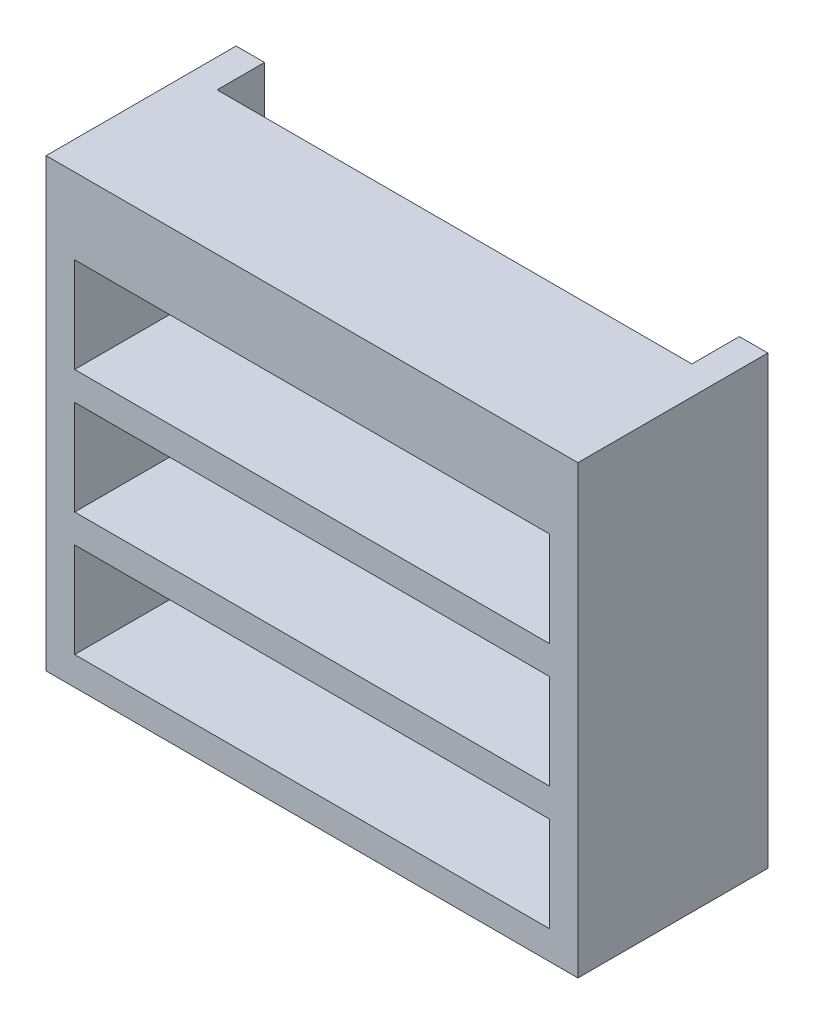
from build123d import *

# Parameters (mm, degrees)
SKETCH_2_W      = 50
SKETCH_2_H      = 10
EXTRUDE_1_DEPTH = 15
SKETCH_3_W      = 3
SKETCH_3_H      = 42
EXTRUDE_2_DEPTH = 5
SKETCH_4_W      = 3
SKETCH_4_H      = 5
EXTRUDE_4_DEPTH = 5
EXTRUDE_5_DEPTH = 5


with BuildPart() as part:
    # 草图2 → 凸台-拉伸1 (new body)
    with BuildSketch(Plane.XY):
        Polygon((-29.132569558, 18.56468986), (-32.132569558, 18.56468986), (-32.132569558, -23.43531014), (-29.132569558, -23.43531014), (23.867430442, -23.43531014), (23.867430442, 18.56468986), align=None)
        with Locations((-4.132569558, 10.56468986)):
            Rectangle(SKETCH_2_W, SKETCH_2_H, mode=Mode.SUBTRACT)
        with Locations((-4.132569558, -2.43531014)):
            Rectangle(SKETCH_2_W, SKETCH_2_H, mode=Mode.SUBTRACT)
        with Locations((-4.132569558, -15.43531014)):
            Rectangle(SKETCH_2_W, SKETCH_2_H, mode=Mode.SUBTRACT)
    extrude(amount=EXTRUDE_1_DEPTH)

    # 草图3 → 凸台-拉伸2 (add)
    with BuildSketch(Plane(origin=(0, 0, 0), x_dir=(-1, 0, 0), z_dir=(0, 0, -1))):
        with Locations((30.632569558, -2.43531014)):
            Rectangle(SKETCH_3_W, SKETCH_3_H)
        with Locations((-22.367430442, -2.43531014)):
            Rectangle(SKETCH_3_W, SKETCH_3_H)
    extrude(amount=EXTRUDE_2_DEPTH)

    # 草图4 → 凸台-拉伸4 (add)
    with BuildSketch(Plane(origin=(0, 18.56468986, 0), x_dir=(1, 0, 0), z_dir=(0, 1, 0))):
        with Locations((-30.632569558, 2.5)):
            Rectangle(SKETCH_4_W, SKETCH_4_H)
        with Locations((22.367430442, 2.5)):
            Rectangle(SKETCH_4_W, SKETCH_4_H)
    extrude(amount=EXTRUDE_4_DEPTH)

    # 草图5 → 凸台-拉伸5 (add)
    with BuildSketch(Plane(origin=(0, 18.56468986, 0), x_dir=(1, 0, 0), z_dir=(0, 1, 0))):
        Polygon((23.867430442, 0), (20.867430442, 0), (-29.132569558, 0), (-32.132569558, 0), (-32.132569558, -15), (23.867430442, -15), align=None)
    extrude(amount=EXTRUDE_5_DEPTH)


solid = part.part
